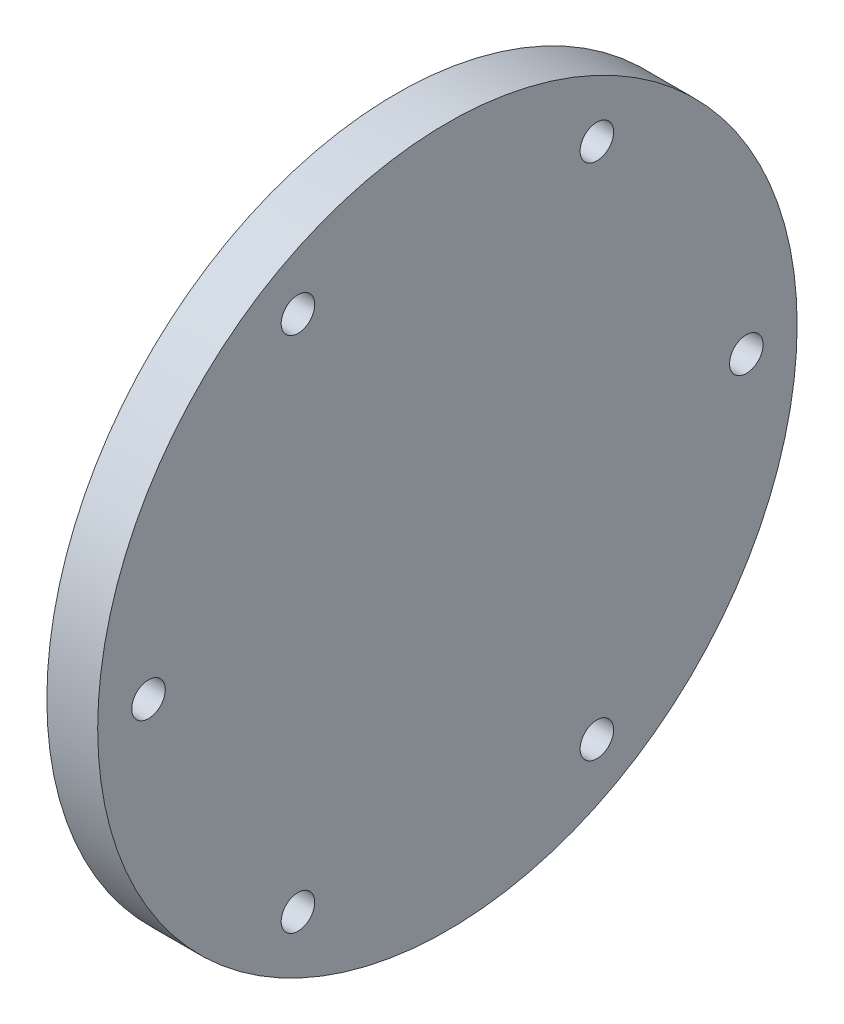
from build123d import *

# Parameters (mm, degrees)
AXIAL_PROFILE_MM_W     = 5
AXIAL_PROFILE_MM_H     = 34.4
AXIAL_HOLES_DEPTH      = 176.574514096
AXIAL_HOLES_DEPTH_BACK = 176.574514096
SKETCH2_R              = 1.65
CUT_EXTRUDE2_START     = 165.2
SKETCH3_R              = 1.65
CUT_EXTRUDE2_DEPTH     = 3.5


with BuildPart() as part:
    # Axial profile (mm) → Full revolution (revolve)
    with BuildSketch(Plane.XY, mode=Mode.PRIVATE) as full_revolution_sk:
        with Locations((166.2, 17.2)):
            Rectangle(AXIAL_PROFILE_MM_W, AXIAL_PROFILE_MM_H)
    revolve(full_revolution_sk.sketch.rotate(Axis((-110, 0, 0), (1, 0, 0)), 90), axis=Axis((-110, 0, 0), (1, 0, 0)))

    # Sketch2 → Axial holes (cut, two sides: drawn at the far end of the back side and taken through both)
    with BuildSketch(Plane(origin=(0, 0, 0), x_dir=(0, 0, -1), z_dir=(1, 0, 0)).offset(-AXIAL_HOLES_DEPTH_BACK)):
        with Locations((-29.4, 0)):
            Circle(SKETCH2_R)
        with Locations((14.7, -25.461146871)):
            Circle(SKETCH2_R)
        with Locations((14.7, 25.461146871)):
            Circle(SKETCH2_R)
    extrude(amount=AXIAL_HOLES_DEPTH + AXIAL_HOLES_DEPTH_BACK, mode=Mode.SUBTRACT)

    # Sketch3 → Cut-Extrude2 (cut)
    with BuildSketch(Plane(origin=(0, 0, 0), x_dir=(0, 0, -1), z_dir=(1, 0, 0)).offset(CUT_EXTRUDE2_START)):
        with Locations((29.4, 0)):
            Circle(SKETCH3_R)
        with Locations((-14.7, 25.461146871)):
            Circle(SKETCH3_R)
        with Locations((-14.7, -25.461146871)):
            Circle(SKETCH3_R)
    extrude(amount=CUT_EXTRUDE2_DEPTH, mode=Mode.SUBTRACT)


solid = part.part
